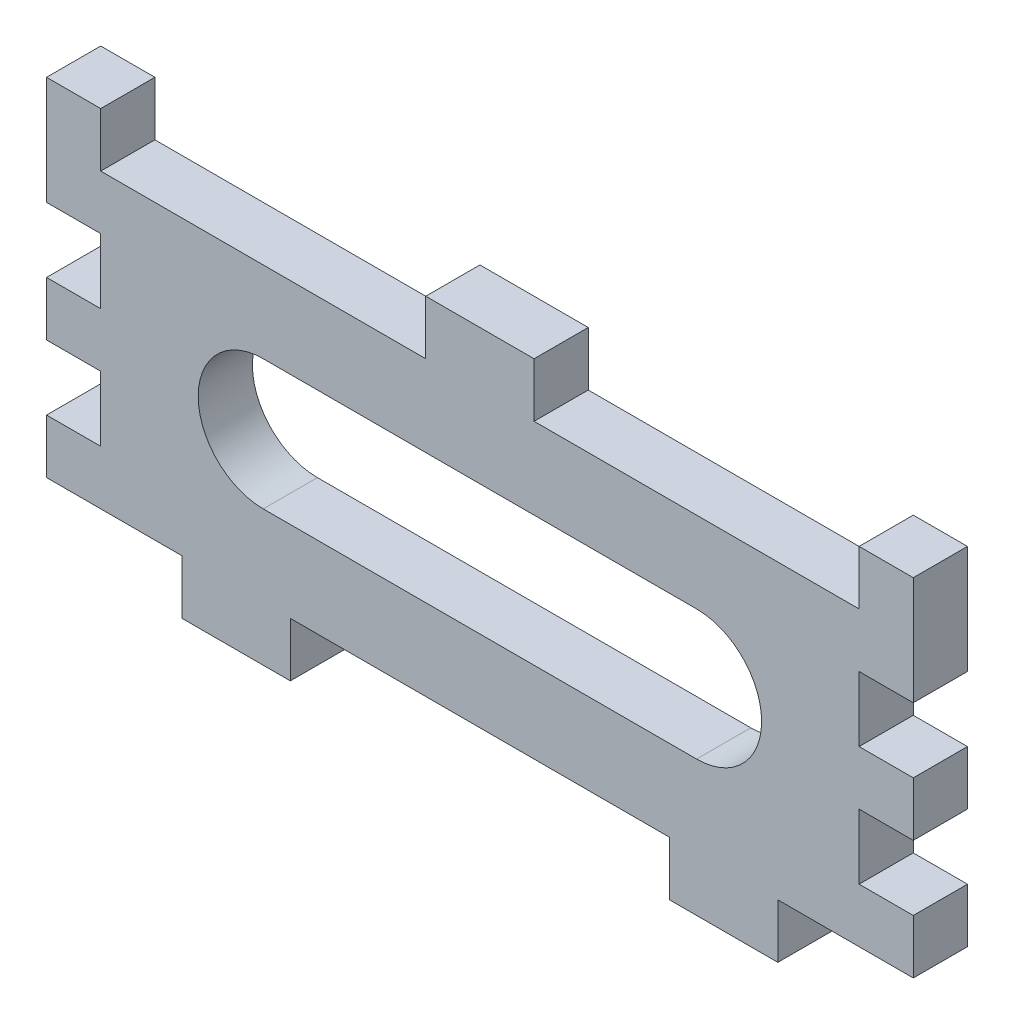
from build123d import *

# Parameters (mm, degrees)
ESQUISSE1_W        = 80
ESQUISSE1_H        = 27
BOSS_EXTRU_1_DEPTH = 5
ESQUISSE3_W        = 5
ESQUISSE3_H        = 6
CR_NEAUX_DEPTH     = 5
ESQUISSE2_W        = 5
ESQUISSE2_H        = 5
ESQUISSE2_W_2      = 10
CR_NEAUX_2_DEPTH   = 5


with BuildPart() as part:
    # Esquisse1 → Boss.-Extru.1 (new body)
    with BuildSketch(Plane.XY):
        with Locations((98.983627477, 156.921111622)):
            Rectangle(ESQUISSE1_W, ESQUISSE1_H)
    extrude(amount=-BOSS_EXTRU_1_DEPTH)

    # Esquisse3 → Cr_neaux (cut)
    with BuildSketch(Plane.XY):
        with Locations((61.483627477, 162.421111622)):
            Rectangle(ESQUISSE3_W, ESQUISSE3_H)
        with Locations((61.483627477, 151.421111622)):
            Rectangle(ESQUISSE3_W, ESQUISSE3_H)
        with Locations((136.483627477, 151.421111622)):
            Rectangle(ESQUISSE3_W, ESQUISSE3_H)
        with Locations((136.483627477, 162.421111622)):
            Rectangle(ESQUISSE3_W, ESQUISSE3_H)
        with BuildLine():
            Line((78.983627477, 162.921111622), (118.983627477, 162.921111622))
            ThreePointArc((118.983627477, 162.921111622), (124.983627477, 156.921111622), (118.983627477, 150.921111622))
            Line((118.983627477, 150.921111622), (78.983627477, 150.921111622))
            ThreePointArc((78.983627477, 150.921111622), (72.983627477, 156.921111622), (78.983627477, 162.921111622))
        make_face()
    extrude(amount=-CR_NEAUX_DEPTH, mode=Mode.SUBTRACT)

    # Esquisse2 → Cr_neaux 2 (add)
    with BuildSketch(Plane.XY):
        with Locations((136.483627477, 172.921111622)):
            Rectangle(ESQUISSE2_W, ESQUISSE2_H)
        with Locations((61.483627477, 172.921111622)):
            Rectangle(ESQUISSE2_W, ESQUISSE2_H)
        with Locations((98.983627477, 172.921111622)):
            Rectangle(ESQUISSE2_W_2, ESQUISSE2_H)
        with Locations((121.483627477, 140.921111622)):
            Rectangle(ESQUISSE2_W_2, ESQUISSE2_H)
        with Locations((76.483627477, 140.921111622)):
            Rectangle(ESQUISSE2_W_2, ESQUISSE2_H)
    extrude(amount=-CR_NEAUX_2_DEPTH)


solid = part.part
